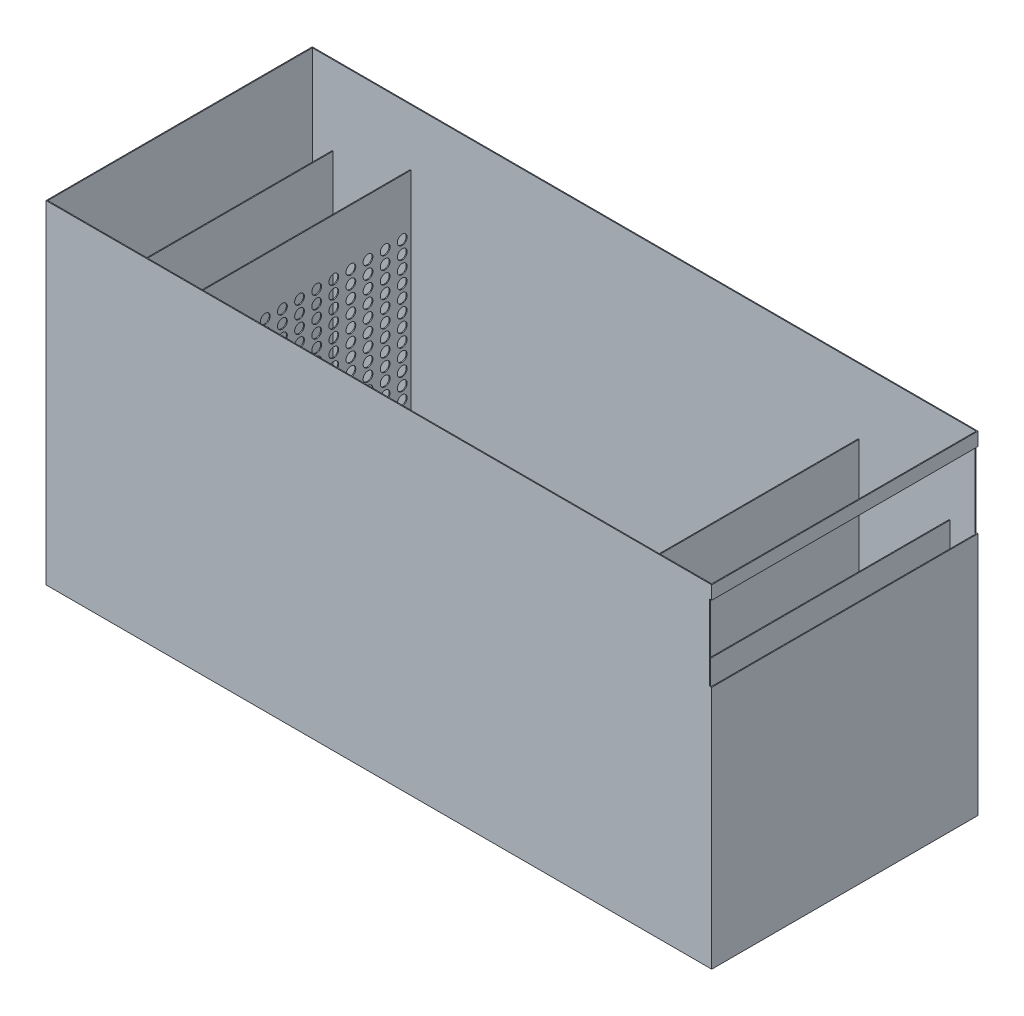
from build123d import *

# Parameters (mm, degrees)
MASTER_FOOTPRINT_W            = 1500
MASTER_FOOTPRINT_H            = 600
BATH_BASE_PLATE_DEPTH         = 750
BATH_SHELL_2MM_T              = -2
SKETCH_1_R                    = 50
INLET_D100_OPENING_DEPTH      = 10
INLET_IMPACT_BAFFLE_START     = 125
SKETCH_2_W                    = 440
SKETCH_2_H                    = 430
INLET_IMPACT_BAFFLE_DEPTH     = 2
DISTRIBUTOR_D22_START         = 250
SKETCH_3_W                    = 540
SKETCH_3_H                    = 648
SKETCH_3_R                    = 11
DISTRIBUTOR_D22_DEPTH         = 2
OUTLET_SUBMERGED_BAFFLE_START = 1280
SKETCH_4_W                    = 500
SKETCH_4_H                    = 330
OUTLET_SUBMERGED_BAFFLE_DEPTH = 2
OVERFLOW_WEIR_Z550_START      = 1440
SKETCH_5_W                    = 590
SKETCH_5_H                    = 548
OVERFLOW_WEIR_Z550_DEPTH      = 2
OUTLET_WEIR_SLOT_W600_START   = 1495
SKETCH_6_W                    = 600
SKETCH_6_H                    = 170
OUTLET_WEIR_SLOT_W600_DEPTH   = 10
SLOPED_SEDIMENT_FLOOR_START   = 275
SLOPED_SEDIMENT_FLOOR_DEPTH   = 975


with BuildPart() as part:
    # MASTER_FOOTPRINT → BATH_BASE_PLATE (new body)
    with BuildSketch(Plane(origin=(0, 0, 0), x_dir=(1, 0, 0), z_dir=(0, 1, 0))):
        with Locations((750, 300)):
            Rectangle(MASTER_FOOTPRINT_W, MASTER_FOOTPRINT_H)
    extrude(amount=BATH_BASE_PLATE_DEPTH)

    # BATH_SHELL_2MM
    bath_shell_2mm_openings = [part.faces().sort_by_distance(p)[0] for p in [
        (750, 750, -300),
    ]]
    offset(amount=BATH_SHELL_2MM_T, openings=bath_shell_2mm_openings, kind=Kind.INTERSECTION)

    # Эскиз1 → INLET_D100_OPENING (cut)
    with BuildSketch(Plane(origin=(0, 0, 0), x_dir=(0, 0, -1), z_dir=(1, 0, 0))):
        with Locations((300, 420)):
            Circle(SKETCH_1_R)
    extrude(amount=INLET_D100_OPENING_DEPTH, mode=Mode.SUBTRACT)

    # Эскиз6 → OUTLET_WEIR_SLOT_W600 (cut)
    with BuildSketch(Plane(origin=(0, 0, 0), x_dir=(0, 0, -1), z_dir=(1, 0, 0)).offset(OUTLET_WEIR_SLOT_W600_START)):
        with Locations((300, 635)):
            Rectangle(SKETCH_6_W, SKETCH_6_H)
    extrude(amount=OUTLET_WEIR_SLOT_W600_DEPTH, mode=Mode.SUBTRACT)

    # Эскиз7 → SLOPED_SEDIMENT_FLOOR (add)
    with BuildSketch(Plane(origin=(0, 0, 0), x_dir=(0, 0, -1), z_dir=(1, 0, 0)).offset(SLOPED_SEDIMENT_FLOOR_START)):
        Polygon((2, -1), (2, 120), (230, -1), align=None)
        Polygon((598, -1), (598, 120), (370, -1), align=None)
    extrude(amount=SLOPED_SEDIMENT_FLOOR_DEPTH)


with BuildPart() as body_2:
    # Эскиз2 → INLET_IMPACT_BAFFLE (new body)
    with BuildSketch(Plane(origin=(0, 0, 0), x_dir=(0, 0, -1), z_dir=(1, 0, 0)).offset(INLET_IMPACT_BAFFLE_START)):
        with Locations((300, 435)):
            Rectangle(SKETCH_2_W, SKETCH_2_H)
    extrude(amount=INLET_IMPACT_BAFFLE_DEPTH)


with BuildPart() as body_3:
    # Эскиз3 → DISTRIBUTOR_D22 (new body)
    with BuildSketch(Plane(origin=(0, 0, 0), x_dir=(0, 0, -1), z_dir=(1, 0, 0)).offset(DISTRIBUTOR_D22_START)):
        with Locations((300, 326)):
            Rectangle(SKETCH_3_W, SKETCH_3_H)
        with Locations((49.285714286, 125)):
            Circle(SKETCH_3_R, mode=Mode.SUBTRACT)
        with Locations((49.285714286, 153.5)):
            Circle(SKETCH_3_R, mode=Mode.SUBTRACT)
        with Locations((49.285714286, 182)):
            Circle(SKETCH_3_R, mode=Mode.SUBTRACT)
        with Locations((49.285714286, 210.5)):
            Circle(SKETCH_3_R, mode=Mode.SUBTRACT)
        with Locations((49.285714286, 239)):
            Circle(SKETCH_3_R, mode=Mode.SUBTRACT)
        with Locations((49.285714286, 267.5)):
            Circle(SKETCH_3_R, mode=Mode.SUBTRACT)
        with Locations((49.285714286, 296)):
            Circle(SKETCH_3_R, mode=Mode.SUBTRACT)
        with Locations((49.285714286, 324.5)):
            Circle(SKETCH_3_R, mode=Mode.SUBTRACT)
        with Locations((49.285714286, 353)):
            Circle(SKETCH_3_R, mode=Mode.SUBTRACT)
        with Locations((49.285714286, 381.5)):
            Circle(SKETCH_3_R, mode=Mode.SUBTRACT)
        with Locations((49.285714286, 410)):
            Circle(SKETCH_3_R, mode=Mode.SUBTRACT)
        with Locations((49.285714286, 438.5)):
            Circle(SKETCH_3_R, mode=Mode.SUBTRACT)
        with Locations((49.285714286, 467)):
            Circle(SKETCH_3_R, mode=Mode.SUBTRACT)
        with Locations((49.285714286, 495.5)):
            Circle(SKETCH_3_R, mode=Mode.SUBTRACT)
        with Locations((49.285714286, 524)):
            Circle(SKETCH_3_R, mode=Mode.SUBTRACT)
        with Locations((87.857142857, 125)):
            Circle(SKETCH_3_R, mode=Mode.SUBTRACT)
        with Locations((87.857142857, 153.5)):
            Circle(SKETCH_3_R, mode=Mode.SUBTRACT)
        with Locations((87.857142857, 182)):
            Circle(SKETCH_3_R, mode=Mode.SUBTRACT)
        with Locations((87.857142857, 210.5)):
            Circle(SKETCH_3_R, mode=Mode.SUBTRACT)
        with Locations((87.857142857, 239)):
            Circle(SKETCH_3_R, mode=Mode.SUBTRACT)
        with Locations((87.857142857, 267.5)):
            Circle(SKETCH_3_R, mode=Mode.SUBTRACT)
        with Locations((87.857142857, 296)):
            Circle(SKETCH_3_R, mode=Mode.SUBTRACT)
        with Locations((87.857142857, 324.5)):
            Circle(SKETCH_3_R, mode=Mode.SUBTRACT)
        with Locations((87.857142857, 353)):
            Circle(SKETCH_3_R, mode=Mode.SUBTRACT)
        with Locations((87.857142857, 381.5)):
            Circle(SKETCH_3_R, mode=Mode.SUBTRACT)
        with Locations((87.857142857, 410)):
            Circle(SKETCH_3_R, mode=Mode.SUBTRACT)
        with Locations((87.857142857, 438.5)):
            Circle(SKETCH_3_R, mode=Mode.SUBTRACT)
        with Locations((87.857142857, 467)):
            Circle(SKETCH_3_R, mode=Mode.SUBTRACT)
        with Locations((87.857142857, 495.5)):
            Circle(SKETCH_3_R, mode=Mode.SUBTRACT)
        with Locations((87.857142857, 524)):
            Circle(SKETCH_3_R, mode=Mode.SUBTRACT)
        with Locations((126.428571429, 125)):
            Circle(SKETCH_3_R, mode=Mode.SUBTRACT)
        with Locations((126.428571429, 153.5)):
            Circle(SKETCH_3_R, mode=Mode.SUBTRACT)
        with Locations((126.428571429, 182)):
            Circle(SKETCH_3_R, mode=Mode.SUBTRACT)
        with Locations((126.428571429, 210.5)):
            Circle(SKETCH_3_R, mode=Mode.SUBTRACT)
        with Locations((126.428571429, 239)):
            Circle(SKETCH_3_R, mode=Mode.SUBTRACT)
        with Locations((126.428571429, 267.5)):
            Circle(SKETCH_3_R, mode=Mode.SUBTRACT)
        with Locations((126.428571429, 296)):
            Circle(SKETCH_3_R, mode=Mode.SUBTRACT)
        with Locations((126.428571429, 324.5)):
            Circle(SKETCH_3_R, mode=Mode.SUBTRACT)
        with Locations((126.428571429, 353)):
            Circle(SKETCH_3_R, mode=Mode.SUBTRACT)
        with Locations((126.428571429, 381.5)):
            Circle(SKETCH_3_R, mode=Mode.SUBTRACT)
        with Locations((126.428571429, 410)):
            Circle(SKETCH_3_R, mode=Mode.SUBTRACT)
        with Locations((126.428571429, 438.5)):
            Circle(SKETCH_3_R, mode=Mode.SUBTRACT)
        with Locations((126.428571429, 467)):
            Circle(SKETCH_3_R, mode=Mode.SUBTRACT)
        with Locations((126.428571429, 495.5)):
            Circle(SKETCH_3_R, mode=Mode.SUBTRACT)
        with Locations((126.428571429, 524)):
            Circle(SKETCH_3_R, mode=Mode.SUBTRACT)
        with Locations((165, 125)):
            Circle(SKETCH_3_R, mode=Mode.SUBTRACT)
        with Locations((165, 153.5)):
            Circle(SKETCH_3_R, mode=Mode.SUBTRACT)
        with Locations((165, 182)):
            Circle(SKETCH_3_R, mode=Mode.SUBTRACT)
        with Locations((165, 210.5)):
            Circle(SKETCH_3_R, mode=Mode.SUBTRACT)
        with Locations((165, 239)):
            Circle(SKETCH_3_R, mode=Mode.SUBTRACT)
        with Locations((165, 267.5)):
            Circle(SKETCH_3_R, mode=Mode.SUBTRACT)
        with Locations((165, 296)):
            Circle(SKETCH_3_R, mode=Mode.SUBTRACT)
        with Locations((165, 324.5)):
            Circle(SKETCH_3_R, mode=Mode.SUBTRACT)
        with Locations((165, 353)):
            Circle(SKETCH_3_R, mode=Mode.SUBTRACT)
        with Locations((165, 381.5)):
            Circle(SKETCH_3_R, mode=Mode.SUBTRACT)
        with Locations((165, 410)):
            Circle(SKETCH_3_R, mode=Mode.SUBTRACT)
        with Locations((165, 438.5)):
            Circle(SKETCH_3_R, mode=Mode.SUBTRACT)
        with Locations((165, 467)):
            Circle(SKETCH_3_R, mode=Mode.SUBTRACT)
        with Locations((165, 495.5)):
            Circle(SKETCH_3_R, mode=Mode.SUBTRACT)
        with Locations((165, 524)):
            Circle(SKETCH_3_R, mode=Mode.SUBTRACT)
        with Locations((203.571428571, 125)):
            Circle(SKETCH_3_R, mode=Mode.SUBTRACT)
        with Locations((203.571428571, 153.5)):
            Circle(SKETCH_3_R, mode=Mode.SUBTRACT)
        with Locations((203.571428571, 182)):
            Circle(SKETCH_3_R, mode=Mode.SUBTRACT)
        with Locations((203.571428571, 210.5)):
            Circle(SKETCH_3_R, mode=Mode.SUBTRACT)
        with Locations((203.571428571, 239)):
            Circle(SKETCH_3_R, mode=Mode.SUBTRACT)
        with Locations((203.571428571, 267.5)):
            Circle(SKETCH_3_R, mode=Mode.SUBTRACT)
        with Locations((203.571428571, 296)):
            Circle(SKETCH_3_R, mode=Mode.SUBTRACT)
        with Locations((203.571428571, 324.5)):
            Circle(SKETCH_3_R, mode=Mode.SUBTRACT)
        with Locations((203.571428571, 353)):
            Circle(SKETCH_3_R, mode=Mode.SUBTRACT)
        with Locations((203.571428571, 381.5)):
            Circle(SKETCH_3_R, mode=Mode.SUBTRACT)
        with Locations((203.571428571, 410)):
            Circle(SKETCH_3_R, mode=Mode.SUBTRACT)
        with Locations((203.571428571, 438.5)):
            Circle(SKETCH_3_R, mode=Mode.SUBTRACT)
        with Locations((203.571428571, 467)):
            Circle(SKETCH_3_R, mode=Mode.SUBTRACT)
        with Locations((203.571428571, 495.5)):
            Circle(SKETCH_3_R, mode=Mode.SUBTRACT)
        with Locations((203.571428571, 524)):
            Circle(SKETCH_3_R, mode=Mode.SUBTRACT)
        with Locations((242.142857143, 125)):
            Circle(SKETCH_3_R, mode=Mode.SUBTRACT)
        with Locations((242.142857143, 153.5)):
            Circle(SKETCH_3_R, mode=Mode.SUBTRACT)
        with Locations((242.142857143, 182)):
            Circle(SKETCH_3_R, mode=Mode.SUBTRACT)
        with Locations((242.142857143, 210.5)):
            Circle(SKETCH_3_R, mode=Mode.SUBTRACT)
        with Locations((242.142857143, 239)):
            Circle(SKETCH_3_R, mode=Mode.SUBTRACT)
        with Locations((242.142857143, 267.5)):
            Circle(SKETCH_3_R, mode=Mode.SUBTRACT)
        with Locations((242.142857143, 296)):
            Circle(SKETCH_3_R, mode=Mode.SUBTRACT)
        with Locations((242.142857143, 324.5)):
            Circle(SKETCH_3_R, mode=Mode.SUBTRACT)
        with Locations((242.142857143, 353)):
            Circle(SKETCH_3_R, mode=Mode.SUBTRACT)
        with Locations((242.142857143, 381.5)):
            Circle(SKETCH_3_R, mode=Mode.SUBTRACT)
        with Locations((242.142857143, 410)):
            Circle(SKETCH_3_R, mode=Mode.SUBTRACT)
        with Locations((242.142857143, 438.5)):
            Circle(SKETCH_3_R, mode=Mode.SUBTRACT)
        with Locations((242.142857143, 467)):
            Circle(SKETCH_3_R, mode=Mode.SUBTRACT)
        with Locations((242.142857143, 495.5)):
            Circle(SKETCH_3_R, mode=Mode.SUBTRACT)
        with Locations((242.142857143, 524)):
            Circle(SKETCH_3_R, mode=Mode.SUBTRACT)
        with Locations((280.714285714, 125)):
            Circle(SKETCH_3_R, mode=Mode.SUBTRACT)
        with Locations((280.714285714, 153.5)):
            Circle(SKETCH_3_R, mode=Mode.SUBTRACT)
        with Locations((280.714285714, 182)):
            Circle(SKETCH_3_R, mode=Mode.SUBTRACT)
        with Locations((280.714285714, 210.5)):
            Circle(SKETCH_3_R, mode=Mode.SUBTRACT)
        with Locations((280.714285714, 239)):
            Circle(SKETCH_3_R, mode=Mode.SUBTRACT)
        with Locations((280.714285714, 267.5)):
            Circle(SKETCH_3_R, mode=Mode.SUBTRACT)
        with Locations((280.714285714, 296)):
            Circle(SKETCH_3_R, mode=Mode.SUBTRACT)
        with Locations((280.714285714, 324.5)):
            Circle(SKETCH_3_R, mode=Mode.SUBTRACT)
        with Locations((280.714285714, 353)):
            Circle(SKETCH_3_R, mode=Mode.SUBTRACT)
        with Locations((280.714285714, 381.5)):
            Circle(SKETCH_3_R, mode=Mode.SUBTRACT)
        with Locations((280.714285714, 410)):
            Circle(SKETCH_3_R, mode=Mode.SUBTRACT)
        with Locations((280.714285714, 438.5)):
            Circle(SKETCH_3_R, mode=Mode.SUBTRACT)
        with Locations((280.714285714, 467)):
            Circle(SKETCH_3_R, mode=Mode.SUBTRACT)
        with Locations((280.714285714, 495.5)):
            Circle(SKETCH_3_R, mode=Mode.SUBTRACT)
        with Locations((280.714285714, 524)):
            Circle(SKETCH_3_R, mode=Mode.SUBTRACT)
        with Locations((319.285714286, 125)):
            Circle(SKETCH_3_R, mode=Mode.SUBTRACT)
        with Locations((319.285714286, 153.5)):
            Circle(SKETCH_3_R, mode=Mode.SUBTRACT)
        with Locations((319.285714286, 182)):
            Circle(SKETCH_3_R, mode=Mode.SUBTRACT)
        with Locations((319.285714286, 210.5)):
            Circle(SKETCH_3_R, mode=Mode.SUBTRACT)
        with Locations((319.285714286, 239)):
            Circle(SKETCH_3_R, mode=Mode.SUBTRACT)
        with Locations((319.285714286, 267.5)):
            Circle(SKETCH_3_R, mode=Mode.SUBTRACT)
        with Locations((319.285714286, 296)):
            Circle(SKETCH_3_R, mode=Mode.SUBTRACT)
        with Locations((319.285714286, 324.5)):
            Circle(SKETCH_3_R, mode=Mode.SUBTRACT)
        with Locations((319.285714286, 353)):
            Circle(SKETCH_3_R, mode=Mode.SUBTRACT)
        with Locations((319.285714286, 381.5)):
            Circle(SKETCH_3_R, mode=Mode.SUBTRACT)
        with Locations((319.285714286, 410)):
            Circle(SKETCH_3_R, mode=Mode.SUBTRACT)
        with Locations((319.285714286, 438.5)):
            Circle(SKETCH_3_R, mode=Mode.SUBTRACT)
        with Locations((319.285714286, 467)):
            Circle(SKETCH_3_R, mode=Mode.SUBTRACT)
        with Locations((319.285714286, 495.5)):
            Circle(SKETCH_3_R, mode=Mode.SUBTRACT)
        with Locations((319.285714286, 524)):
            Circle(SKETCH_3_R, mode=Mode.SUBTRACT)
        with Locations((357.857142857, 125)):
            Circle(SKETCH_3_R, mode=Mode.SUBTRACT)
        with Locations((357.857142857, 153.5)):
            Circle(SKETCH_3_R, mode=Mode.SUBTRACT)
        with Locations((357.857142857, 182)):
            Circle(SKETCH_3_R, mode=Mode.SUBTRACT)
        with Locations((357.857142857, 210.5)):
            Circle(SKETCH_3_R, mode=Mode.SUBTRACT)
        with Locations((357.857142857, 239)):
            Circle(SKETCH_3_R, mode=Mode.SUBTRACT)
        with Locations((357.857142857, 267.5)):
            Circle(SKETCH_3_R, mode=Mode.SUBTRACT)
        with Locations((357.857142857, 296)):
            Circle(SKETCH_3_R, mode=Mode.SUBTRACT)
        with Locations((357.857142857, 324.5)):
            Circle(SKETCH_3_R, mode=Mode.SUBTRACT)
        with Locations((357.857142857, 353)):
            Circle(SKETCH_3_R, mode=Mode.SUBTRACT)
        with Locations((357.857142857, 381.5)):
            Circle(SKETCH_3_R, mode=Mode.SUBTRACT)
        with Locations((357.857142857, 410)):
            Circle(SKETCH_3_R, mode=Mode.SUBTRACT)
        with Locations((357.857142857, 438.5)):
            Circle(SKETCH_3_R, mode=Mode.SUBTRACT)
        with Locations((357.857142857, 467)):
            Circle(SKETCH_3_R, mode=Mode.SUBTRACT)
        with Locations((357.857142857, 495.5)):
            Circle(SKETCH_3_R, mode=Mode.SUBTRACT)
        with Locations((357.857142857, 524)):
            Circle(SKETCH_3_R, mode=Mode.SUBTRACT)
        with Locations((396.428571429, 125)):
            Circle(SKETCH_3_R, mode=Mode.SUBTRACT)
        with Locations((396.428571429, 153.5)):
            Circle(SKETCH_3_R, mode=Mode.SUBTRACT)
        with Locations((396.428571429, 182)):
            Circle(SKETCH_3_R, mode=Mode.SUBTRACT)
        with Locations((396.428571429, 210.5)):
            Circle(SKETCH_3_R, mode=Mode.SUBTRACT)
        with Locations((396.428571429, 239)):
            Circle(SKETCH_3_R, mode=Mode.SUBTRACT)
        with Locations((396.428571429, 267.5)):
            Circle(SKETCH_3_R, mode=Mode.SUBTRACT)
        with Locations((396.428571429, 296)):
            Circle(SKETCH_3_R, mode=Mode.SUBTRACT)
        with Locations((396.428571429, 324.5)):
            Circle(SKETCH_3_R, mode=Mode.SUBTRACT)
        with Locations((396.428571429, 353)):
            Circle(SKETCH_3_R, mode=Mode.SUBTRACT)
        with Locations((396.428571429, 381.5)):
            Circle(SKETCH_3_R, mode=Mode.SUBTRACT)
        with Locations((396.428571429, 410)):
            Circle(SKETCH_3_R, mode=Mode.SUBTRACT)
        with Locations((396.428571429, 438.5)):
            Circle(SKETCH_3_R, mode=Mode.SUBTRACT)
        with Locations((396.428571429, 467)):
            Circle(SKETCH_3_R, mode=Mode.SUBTRACT)
        with Locations((396.428571429, 495.5)):
            Circle(SKETCH_3_R, mode=Mode.SUBTRACT)
        with Locations((396.428571429, 524)):
            Circle(SKETCH_3_R, mode=Mode.SUBTRACT)
        with Locations((435, 125)):
            Circle(SKETCH_3_R, mode=Mode.SUBTRACT)
        with Locations((435, 153.5)):
            Circle(SKETCH_3_R, mode=Mode.SUBTRACT)
        with Locations((435, 182)):
            Circle(SKETCH_3_R, mode=Mode.SUBTRACT)
        with Locations((435, 210.5)):
            Circle(SKETCH_3_R, mode=Mode.SUBTRACT)
        with Locations((435, 239)):
            Circle(SKETCH_3_R, mode=Mode.SUBTRACT)
        with Locations((435, 267.5)):
            Circle(SKETCH_3_R, mode=Mode.SUBTRACT)
        with Locations((435, 296)):
            Circle(SKETCH_3_R, mode=Mode.SUBTRACT)
        with Locations((435, 324.5)):
            Circle(SKETCH_3_R, mode=Mode.SUBTRACT)
        with Locations((435, 353)):
            Circle(SKETCH_3_R, mode=Mode.SUBTRACT)
        with Locations((435, 381.5)):
            Circle(SKETCH_3_R, mode=Mode.SUBTRACT)
        with Locations((435, 410)):
            Circle(SKETCH_3_R, mode=Mode.SUBTRACT)
        with Locations((435, 438.5)):
            Circle(SKETCH_3_R, mode=Mode.SUBTRACT)
        with Locations((435, 467)):
            Circle(SKETCH_3_R, mode=Mode.SUBTRACT)
        with Locations((435, 495.5)):
            Circle(SKETCH_3_R, mode=Mode.SUBTRACT)
        with Locations((435, 524)):
            Circle(SKETCH_3_R, mode=Mode.SUBTRACT)
        with Locations((473.571428571, 125)):
            Circle(SKETCH_3_R, mode=Mode.SUBTRACT)
        with Locations((473.571428571, 153.5)):
            Circle(SKETCH_3_R, mode=Mode.SUBTRACT)
        with Locations((473.571428571, 182)):
            Circle(SKETCH_3_R, mode=Mode.SUBTRACT)
        with Locations((473.571428571, 210.5)):
            Circle(SKETCH_3_R, mode=Mode.SUBTRACT)
        with Locations((473.571428571, 239)):
            Circle(SKETCH_3_R, mode=Mode.SUBTRACT)
        with Locations((473.571428571, 267.5)):
            Circle(SKETCH_3_R, mode=Mode.SUBTRACT)
        with Locations((473.571428571, 296)):
            Circle(SKETCH_3_R, mode=Mode.SUBTRACT)
        with Locations((473.571428571, 324.5)):
            Circle(SKETCH_3_R, mode=Mode.SUBTRACT)
        with Locations((473.571428571, 353)):
            Circle(SKETCH_3_R, mode=Mode.SUBTRACT)
        with Locations((473.571428571, 381.5)):
            Circle(SKETCH_3_R, mode=Mode.SUBTRACT)
        with Locations((473.571428571, 410)):
            Circle(SKETCH_3_R, mode=Mode.SUBTRACT)
        with Locations((473.571428571, 438.5)):
            Circle(SKETCH_3_R, mode=Mode.SUBTRACT)
        with Locations((473.571428571, 467)):
            Circle(SKETCH_3_R, mode=Mode.SUBTRACT)
        with Locations((473.571428571, 495.5)):
            Circle(SKETCH_3_R, mode=Mode.SUBTRACT)
        with Locations((473.571428571, 524)):
            Circle(SKETCH_3_R, mode=Mode.SUBTRACT)
        with Locations((512.142857143, 125)):
            Circle(SKETCH_3_R, mode=Mode.SUBTRACT)
        with Locations((512.142857143, 153.5)):
            Circle(SKETCH_3_R, mode=Mode.SUBTRACT)
        with Locations((512.142857143, 182)):
            Circle(SKETCH_3_R, mode=Mode.SUBTRACT)
        with Locations((512.142857143, 210.5)):
            Circle(SKETCH_3_R, mode=Mode.SUBTRACT)
        with Locations((512.142857143, 239)):
            Circle(SKETCH_3_R, mode=Mode.SUBTRACT)
        with Locations((512.142857143, 267.5)):
            Circle(SKETCH_3_R, mode=Mode.SUBTRACT)
        with Locations((512.142857143, 296)):
            Circle(SKETCH_3_R, mode=Mode.SUBTRACT)
        with Locations((512.142857143, 324.5)):
            Circle(SKETCH_3_R, mode=Mode.SUBTRACT)
        with Locations((512.142857143, 353)):
            Circle(SKETCH_3_R, mode=Mode.SUBTRACT)
        with Locations((512.142857143, 381.5)):
            Circle(SKETCH_3_R, mode=Mode.SUBTRACT)
        with Locations((512.142857143, 410)):
            Circle(SKETCH_3_R, mode=Mode.SUBTRACT)
        with Locations((512.142857143, 438.5)):
            Circle(SKETCH_3_R, mode=Mode.SUBTRACT)
        with Locations((512.142857143, 467)):
            Circle(SKETCH_3_R, mode=Mode.SUBTRACT)
        with Locations((512.142857143, 495.5)):
            Circle(SKETCH_3_R, mode=Mode.SUBTRACT)
        with Locations((512.142857143, 524)):
            Circle(SKETCH_3_R, mode=Mode.SUBTRACT)
        with Locations((550.714285714, 125)):
            Circle(SKETCH_3_R, mode=Mode.SUBTRACT)
        with Locations((550.714285714, 153.5)):
            Circle(SKETCH_3_R, mode=Mode.SUBTRACT)
        with Locations((550.714285714, 182)):
            Circle(SKETCH_3_R, mode=Mode.SUBTRACT)
        with Locations((550.714285714, 210.5)):
            Circle(SKETCH_3_R, mode=Mode.SUBTRACT)
        with Locations((550.714285714, 239)):
            Circle(SKETCH_3_R, mode=Mode.SUBTRACT)
        with Locations((550.714285714, 267.5)):
            Circle(SKETCH_3_R, mode=Mode.SUBTRACT)
        with Locations((550.714285714, 296)):
            Circle(SKETCH_3_R, mode=Mode.SUBTRACT)
        with Locations((550.714285714, 324.5)):
            Circle(SKETCH_3_R, mode=Mode.SUBTRACT)
        with Locations((550.714285714, 353)):
            Circle(SKETCH_3_R, mode=Mode.SUBTRACT)
        with Locations((550.714285714, 381.5)):
            Circle(SKETCH_3_R, mode=Mode.SUBTRACT)
        with Locations((550.714285714, 410)):
            Circle(SKETCH_3_R, mode=Mode.SUBTRACT)
        with Locations((550.714285714, 438.5)):
            Circle(SKETCH_3_R, mode=Mode.SUBTRACT)
        with Locations((550.714285714, 467)):
            Circle(SKETCH_3_R, mode=Mode.SUBTRACT)
        with Locations((550.714285714, 495.5)):
            Circle(SKETCH_3_R, mode=Mode.SUBTRACT)
        with Locations((550.714285714, 524)):
            Circle(SKETCH_3_R, mode=Mode.SUBTRACT)
    extrude(amount=DISTRIBUTOR_D22_DEPTH)


with BuildPart() as body_4:
    # Эскиз4 → OUTLET_SUBMERGED_BAFFLE (new body)
    with BuildSketch(Plane(origin=(0, 0, 0), x_dir=(0, 0, -1), z_dir=(1, 0, 0)).offset(OUTLET_SUBMERGED_BAFFLE_START)):
        with Locations((300, 485)):
            Rectangle(SKETCH_4_W, SKETCH_4_H)
    extrude(amount=OUTLET_SUBMERGED_BAFFLE_DEPTH)


with BuildPart() as body_5:
    # Эскиз5 → OVERFLOW_WEIR_Z550 (new body)
    with BuildSketch(Plane(origin=(0, 0, 0), x_dir=(0, 0, -1), z_dir=(1, 0, 0)).offset(OVERFLOW_WEIR_Z550_START)):
        with Locations((300, 276)):
            Rectangle(SKETCH_5_W, SKETCH_5_H)
    extrude(amount=OVERFLOW_WEIR_Z550_DEPTH)


solid = Compound([part.part, body_2.part, body_3.part, body_4.part, body_5.part])
